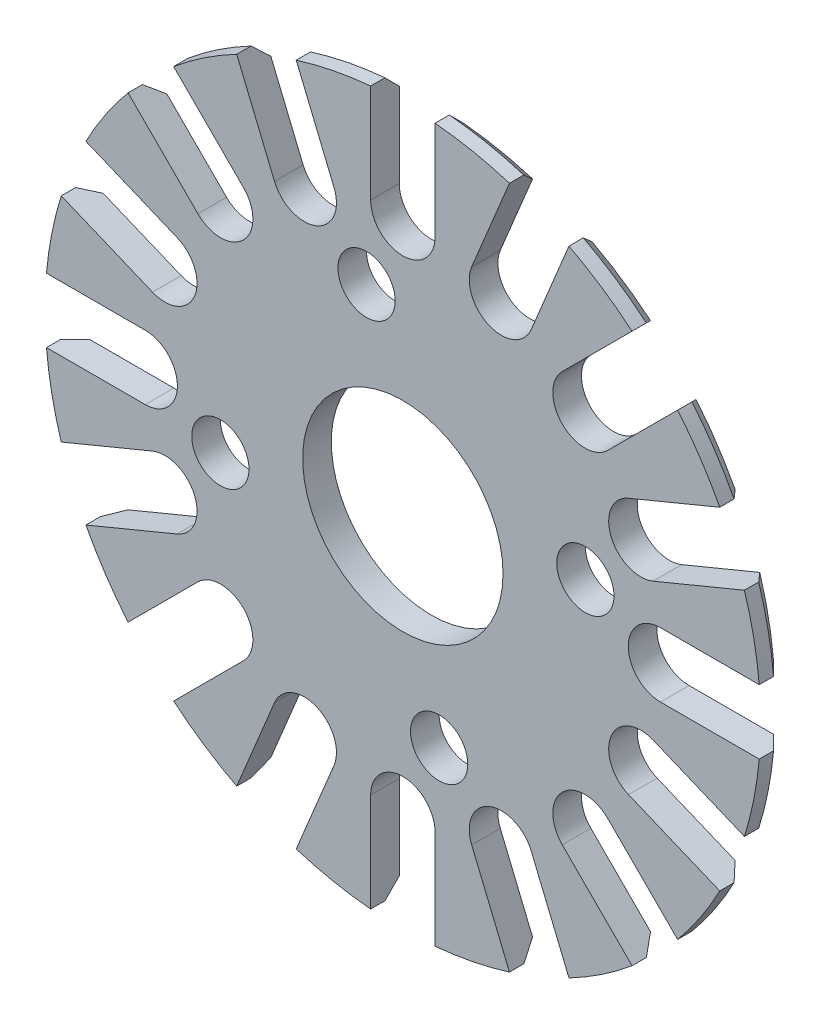
from build123d import *

# Parameters (mm, degrees)
SKETCH_1_R               = 25
EXTRUDE_1_DEPTH          = 2
SKETCH_2_R               = 7
CUT_EXTRUDE_2_DEPTH      = 3
SKETCH_3_R               = 2
CUT_EXTRUDE_3_DEPTH      = 3
PATTERN_CIRCULAR_1_COUNT = 4
CHAMFER_1_SIZE           = 1
CUT_EXTRUDE_START        = -3
CUT_EXTRUDE_4_DEPTH      = 3
PATTERN_CIRCULAR_3_COUNT = 16


with BuildPart() as part:
    # 草图1 → 拉伸1 (new body)
    with BuildSketch(Plane.XY):
        Circle(SKETCH_1_R)
    extrude(amount=EXTRUDE_1_DEPTH)

    # 草图2 → 拉伸2 (cut)
    with BuildSketch(Plane.XY.offset(2)):
        Circle(SKETCH_2_R)
    extrude(amount=-CUT_EXTRUDE_2_DEPTH, mode=Mode.SUBTRACT)

    # 草图3 → 拉伸3 (cut)
    with BuildSketch(Plane.XY.offset(2)):
        with Locations((-2.536174186, 12.750208645)):
            Circle(SKETCH_3_R)
    cut_extrude_3 = extrude(amount=-CUT_EXTRUDE_3_DEPTH, mode=Mode.SUBTRACT)

    # 阵列(圆周)1: 拉伸3 ×4 about axis
    pattern_circular_1_axis = Axis((0, 0, 0), (0, 0, 1))
    for i in range(1, PATTERN_CIRCULAR_1_COUNT):
        add(cut_extrude_3.rotate(pattern_circular_1_axis, i * 360 / PATTERN_CIRCULAR_1_COUNT), mode=Mode.SUBTRACT)

    # 倒角1
    chamfer_1_edges = [part.edges().sort_by_distance(p)[0] for p in [
        (-25, 0, 0),
    ]]
    chamfer(chamfer_1_edges, length=CHAMFER_1_SIZE)

    # 草图4 → 拉伸4 (cut)
    with BuildSketch(Plane.XY.offset(2).offset(CUT_EXTRUDE_START)):
        with BuildLine():
            Line((-18, 2.25), (-24.898544134, 2.25))
            ThreePointArc((-24.898544134, 2.25), (-25, 0), (-24.898544134, -2.25))
            Line((-24.898544134, -2.25), (-18, -2.25))
            ThreePointArc((-18, -2.25), (-15.75, 0), (-18, 2.25))
        make_face()
    cut_extrude_4 = extrude(amount=CUT_EXTRUDE_4_DEPTH, mode=Mode.SUBTRACT)

    # 阵列(圆周)3: 拉伸4 ×16 about axis
    pattern_circular_3_axis = Axis((0, 0, 0), (0, 0, 1))
    for i in range(1, PATTERN_CIRCULAR_3_COUNT):
        add(cut_extrude_4.rotate(pattern_circular_3_axis, i * 360 / PATTERN_CIRCULAR_3_COUNT), mode=Mode.SUBTRACT)


solid = part.part
